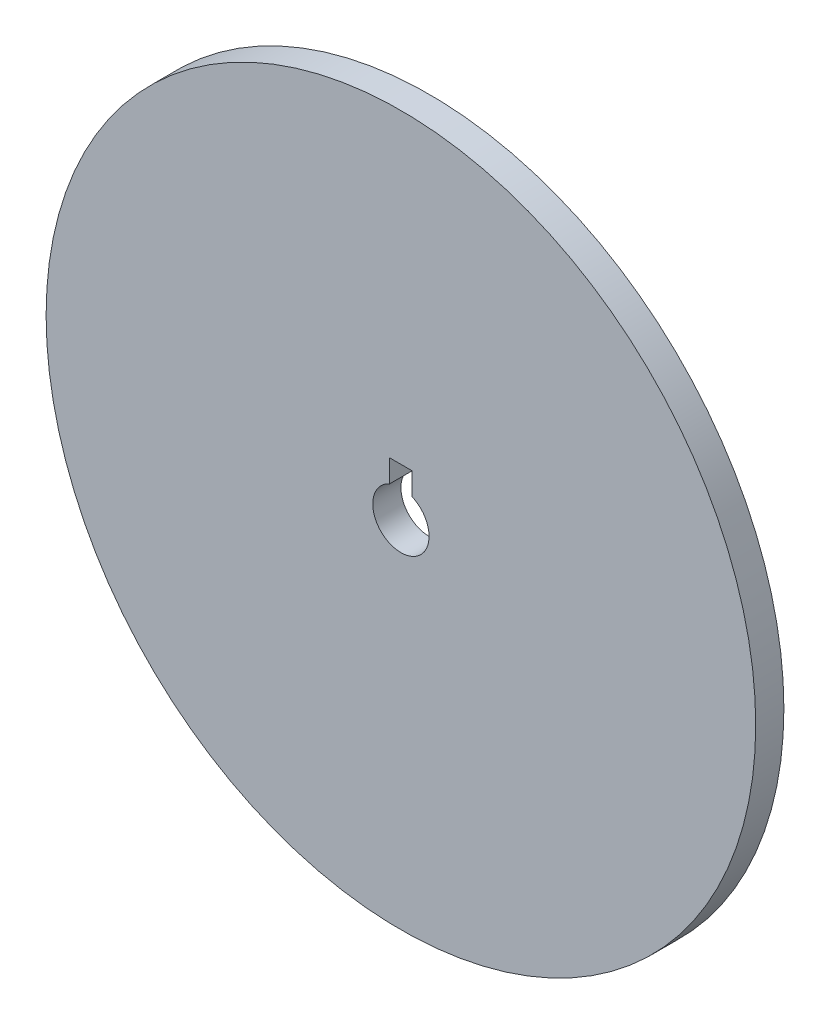
from build123d import *

# Parameters (mm, degrees)
IZIM1_R                     = 63
Y_KSEKLIK_EKSTR_ZYON1_DEPTH = 5
IZIM2_R                     = 5
KES_EKSTR_ZYON1_DEPTH       = 10
IZIM3_W                     = 4
IZIM3_H                     = 4
KES_EKSTR_ZYON2_DEPTH       = 8


with BuildPart() as part:
    # Çizim1 → Yükseklik-Ekstrüzyon1 (new body)
    with BuildSketch(Plane.XY):
        Circle(IZIM1_R)
    extrude(amount=Y_KSEKLIK_EKSTR_ZYON1_DEPTH)

    # Çizim2 → Kes-Ekstrüzyon1 (cut)
    with BuildSketch(Plane.XY.offset(5)):
        Circle(IZIM2_R)
    extrude(amount=-KES_EKSTR_ZYON1_DEPTH, mode=Mode.SUBTRACT)

    # Çizim3 → Kes-Ekstrüzyon2 (cut)
    with BuildSketch(Plane(origin=(0, 0, 0), x_dir=(-1, 0, 0), z_dir=(0, 0, -1))):
        with Locations((0, 6.582575695)):
            Rectangle(IZIM3_W, IZIM3_H)
    extrude(amount=-KES_EKSTR_ZYON2_DEPTH, mode=Mode.SUBTRACT)


solid = part.part
